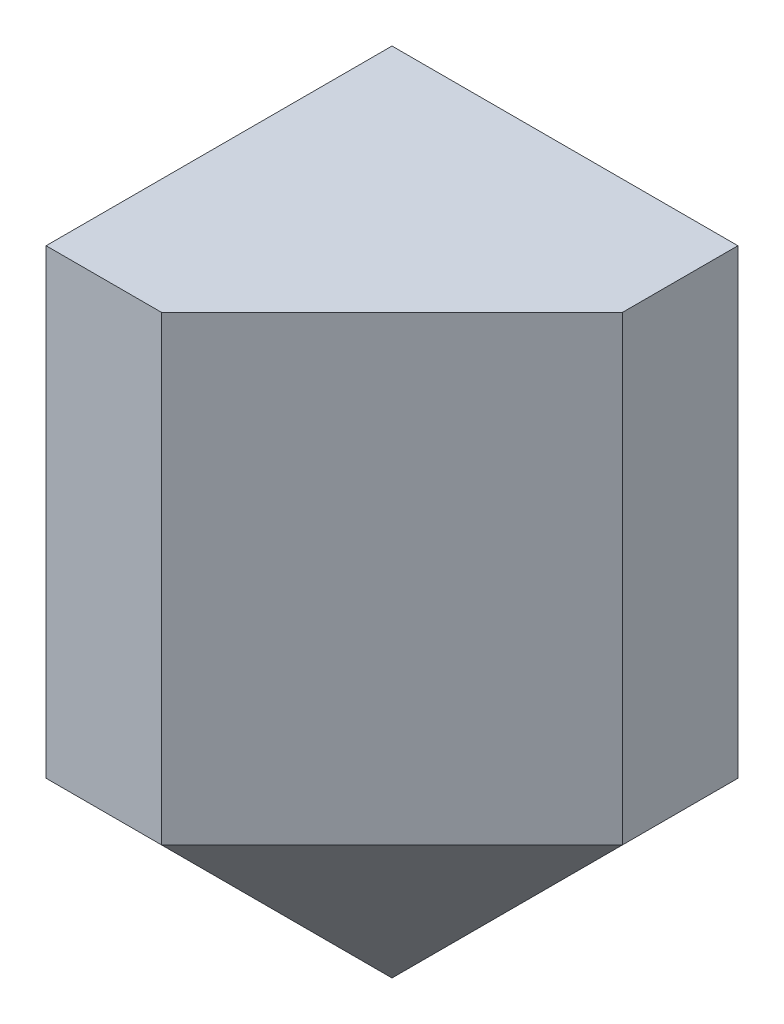
from build123d import *

# Parameters (mm, degrees)
SCHIZZO1_W                   = 30
SCHIZZO1_H                   = 40
ESTRUSIONE_ESTRUSIONE1_DEPTH = 30
SMUSSO1_SIZE                 = 20
ESTRUSIONE_ESTRUSIONE2_DEPTH = 20
FORO_PER_VITE_M5_1_D         = 5.5
FORO_PER_VITE_M5_1_DEPTH     = 13
FORO_PER_VITE_M5_1_TIP       = 1.652366702
FORO_PER_VITE_M5_2_D         = 5.5
FORO_PER_VITE_M5_2_DEPTH     = 13
FORO_PER_VITE_M5_2_TIP       = 1.652366702


with BuildPart() as part:
    # Schizzo1 → Estrusione-Estrusione1 (new body)
    with BuildSketch(Plane.XY):
        with Locations((15, 20)):
            Rectangle(SCHIZZO1_W, SCHIZZO1_H)
    extrude(amount=ESTRUSIONE_ESTRUSIONE1_DEPTH)

    # Smusso1
    smusso1_edges = [part.edges().sort_by_distance(p)[0] for p in [
        (30, 20, 30),
        (30, 0, 15),
        (15, 0, 30),
    ]]
    chamfer(smusso1_edges, length=SMUSSO1_SIZE)

    # Schizzo2 → Estrusione-Estrusione2 (add)
    with BuildSketch(Plane(origin=(0, 40, 0), x_dir=(1, 0, 0), z_dir=(0, 1, 0))):
        Polygon((0, 0), (30, 0), (30, -10), (10, -30), (0, -30), align=None)
    extrude(amount=ESTRUSIONE_ESTRUSIONE2_DEPTH)

    # Foro per Vite M5-1
    with Locations(Plane.ZY):
        with Locations((18, 20), (18, 48)):
            Hole(FORO_PER_VITE_M5_1_D / 2, depth=FORO_PER_VITE_M5_1_DEPTH)
            with Locations((0, 0, -(FORO_PER_VITE_M5_1_DEPTH + FORO_PER_VITE_M5_1_TIP / 2))):  # 118° drill point
                Cone(0, FORO_PER_VITE_M5_1_D / 2, FORO_PER_VITE_M5_1_TIP, mode=Mode.SUBTRACT)

    # Foro per Vite M5-2
    with Locations(Plane(origin=(18, 20, 0), x_dir=(-1, 0, 0), z_dir=(0, 0, -1))):
        with Locations((0, 0), (4, 28)):
            Hole(FORO_PER_VITE_M5_2_D / 2, depth=FORO_PER_VITE_M5_2_DEPTH)
            with Locations((0, 0, -(FORO_PER_VITE_M5_2_DEPTH + FORO_PER_VITE_M5_2_TIP / 2))):  # 118° drill point
                Cone(0, FORO_PER_VITE_M5_2_D / 2, FORO_PER_VITE_M5_2_TIP, mode=Mode.SUBTRACT)


solid = part.part
